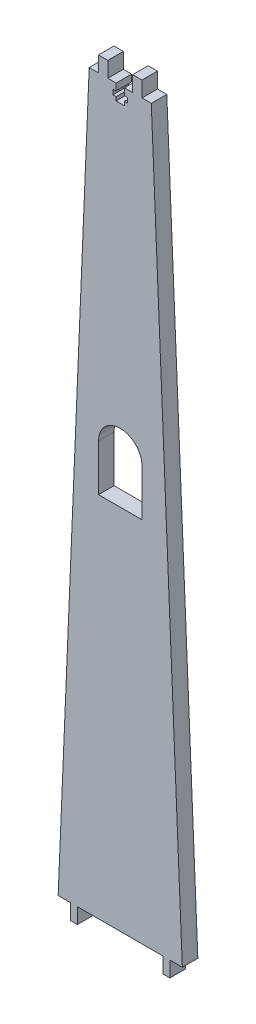
from build123d import *

# Parameters (mm, degrees)
BOSS_EXTRUDE1_DEPTH = 6.35


with BuildPart() as part:
    # Sketch1 → Boss-Extrude1 (new body)
    with BuildSketch(Plane.XY):
        Polygon((25.4, 0), (12.7, 299.72), (8.89, 299.72), (8.89, 306.07), (5.08, 306.07), (5.08, 299.72), (1.7, 299.72), (1.7, 296.926), (2.97, 296.926), (2.97, 294.894), (1.7, 294.894), (1.7, 293.37), (-1.7, 293.37), (-1.7, 294.894), (-2.97, 294.894), (-2.97, 296.926), (-1.7, 296.926), (-1.7, 299.72), (-5.08, 299.72), (-5.08, 306.07), (-8.89, 306.07), (-8.89, 299.72), (-12.7, 299.72), (-25.4, 0), (-20.32, 0), (-20.32, -6.35), (-17.526, -6.35), (-17.526, 0), (17.526, 0), (17.526, -6.35), (20.32, -6.35), (20.32, 0), align=None)
        with BuildLine():
            Line((-8.89, 150.297214184), (8.89, 150.297214184))
            Line((8.89, 150.297214184), (8.89, 169.347214184))
            ThreePointArc((8.89, 169.347214184), (0, 178.237214184), (-8.89, 169.347214184))
            Line((-8.89, 169.347214184), (-8.89, 150.297214184))
        make_face(mode=Mode.SUBTRACT)
    extrude(amount=BOSS_EXTRUDE1_DEPTH)


solid = part.part
